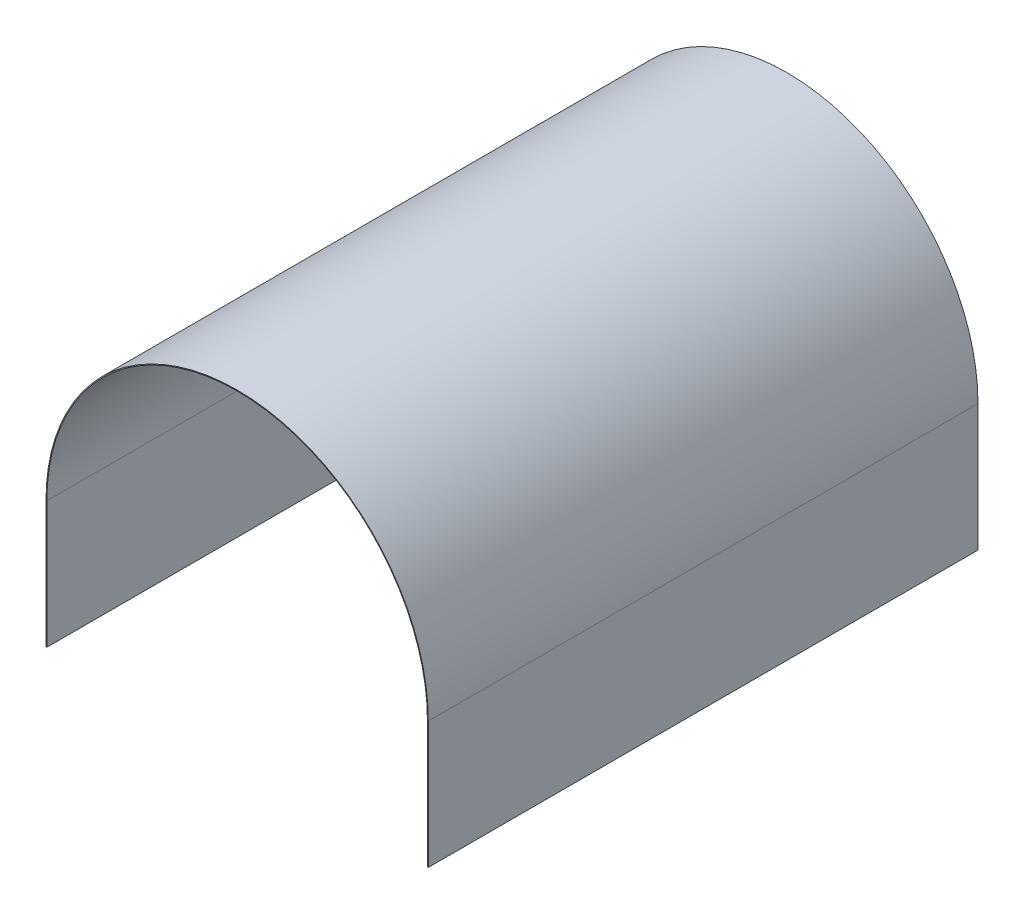
from build123d import *

# Parameters (mm, degrees)
BOSS_EXTRUDE1_DEPTH = 660.4
CUT_EXTRUDE1_DEPTH  = 660.4


with BuildPart() as part:
    # Sketch1 → Boss-Extrude1 (new body)
    with BuildSketch(Plane.XY):
        with BuildLine():
            Line((-228.6, -36.83), (-228.6, -189.23))
            Line((-228.6, -189.23), (230.632, -189.23))
            Line((230.632, -189.23), (230.632, -36.83))
            ThreePointArc((230.632, -36.83), (1.016, 192.786), (-228.6, -36.83))
        make_face()
    extrude(amount=BOSS_EXTRUDE1_DEPTH)

    # Sketch2 → Cut-Extrude1 (cut)
    with BuildSketch(Plane.XY.offset(660.4)):
        with BuildLine():
            Line((-227.584, -36.83), (-227.584, -189.23))
            Line((-227.584, -189.23), (229.616, -189.23))
            Line((229.616, -189.23), (229.616, -36.83))
            ThreePointArc((229.616, -36.83), (1.016, 191.77), (-227.584, -36.83))
        make_face()
    extrude(amount=-CUT_EXTRUDE1_DEPTH, mode=Mode.SUBTRACT)


solid = part.part
